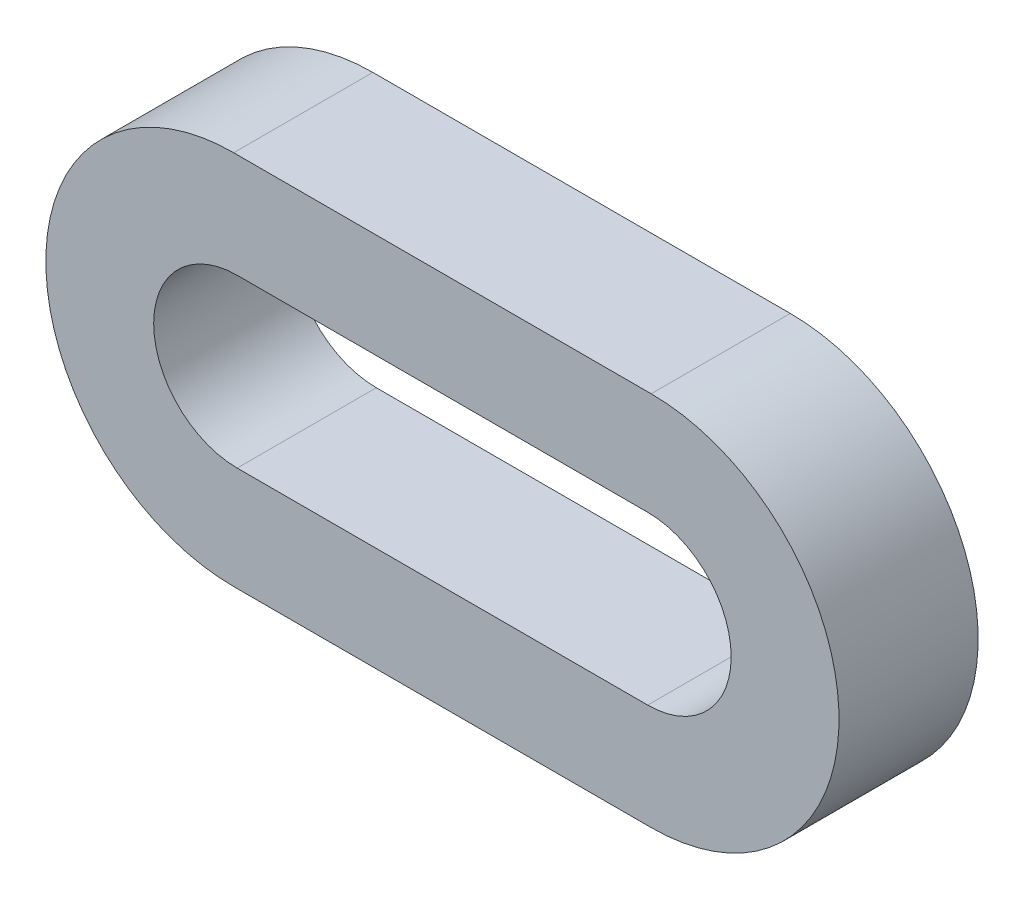
from build123d import *

# Parameters (mm, degrees)
PROFILE_DEPTH         = 1
USBCCUTOUT_DEPTH      = 7.385922016
USBCCUTOUT_DEPTH_BACK = 7.385922016


with BuildPart() as part:
    # ProfileS → Profile (new, symmetric)
    with BuildSketch(Plane.XY):
        with BuildLine():
            Line((-3, 2.7), (3, 2.7))
            ThreePointArc((3, 2.7), (5.7, 0), (3, -2.7))
            Line((3, -2.7), (-3, -2.7))
            ThreePointArc((-3, -2.7), (-5.7, 0), (-3, 2.7))
        make_face()
    extrude(amount=PROFILE_DEPTH, both=True)

    # USBCCutoutS → USBCCutout (cut, two sides: drawn at the far end of the back side and taken through both)
    with BuildSketch(Plane.XY.offset(-USBCCUTOUT_DEPTH_BACK)):
        with BuildLine():
            Line((-2.95, 1.2), (2.95, 1.2))
            ThreePointArc((2.95, 1.2), (4.15, 0), (2.95, -1.2))
            Line((2.95, -1.2), (-2.95, -1.2))
            ThreePointArc((-2.95, -1.2), (-4.15, 0), (-2.95, 1.2))
        make_face()
    extrude(amount=USBCCUTOUT_DEPTH + USBCCUTOUT_DEPTH_BACK, mode=Mode.SUBTRACT)


solid = part.part
